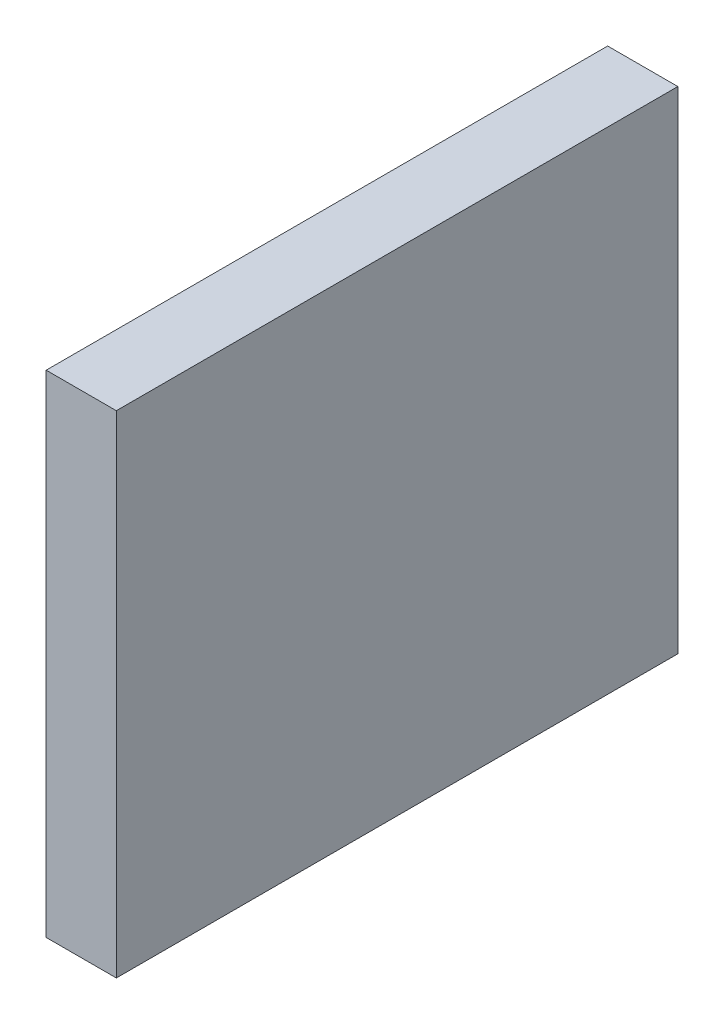
from build123d import *

# Parameters (mm, degrees)
SKETCH1_W           = 25.4
SKETCH1_H           = 22.225
BOSS_EXTRUDE1_DEPTH = 3.175


with BuildPart() as part:
    # Sketch1 → Boss-Extrude1 (new body)
    with BuildSketch(Plane(origin=(0, 0, 0), x_dir=(0, 0, -1), z_dir=(1, 0, 0))):
        with Locations((12.7, 11.1125)):
            Rectangle(SKETCH1_W, SKETCH1_H)
    extrude(amount=BOSS_EXTRUDE1_DEPTH)


solid = part.part
